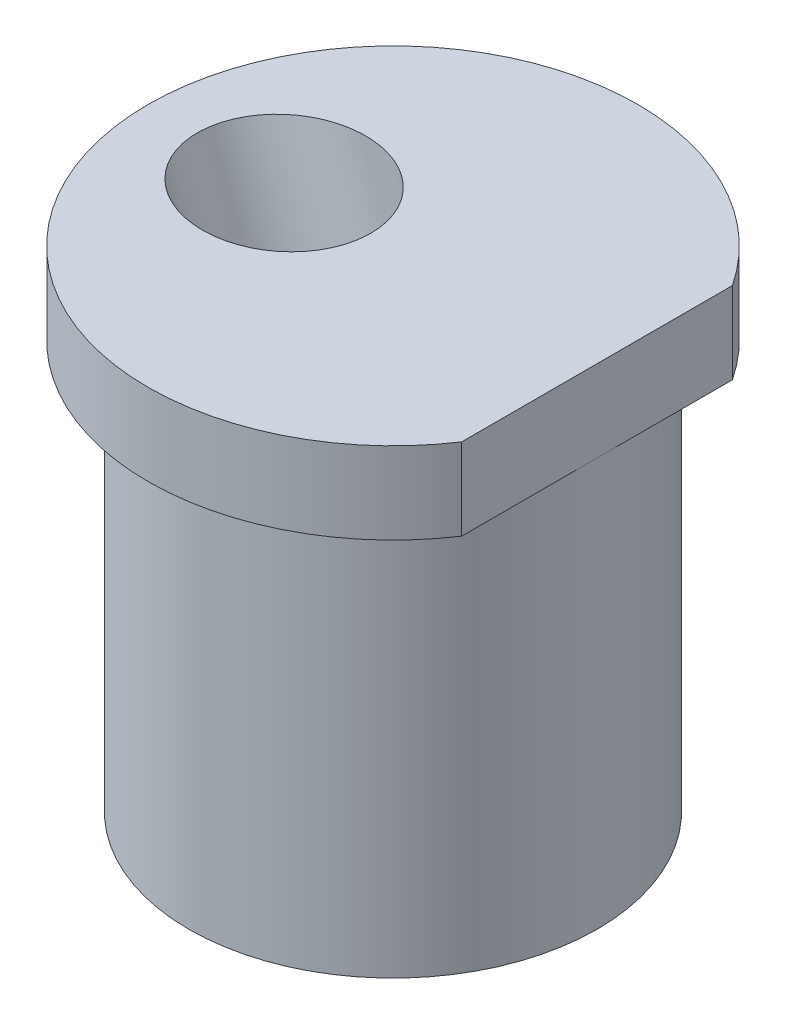
from build123d import *

# Parameters (mm, degrees)
SKETCH4_W          = 19.505959246
SKETCH4_H          = 52.283096245
CUT_EXTRUDE1_DEPTH = 18


with BuildPart() as part:
    # Sketch1 → Revolve1 (revolve)
    with BuildSketch(Plane.XY, mode=Mode.PRIVATE) as revolve1_sk:
        Polygon((0, 0), (0, 60), (30, 60), (30, 50), (25, 50), (25, 0), align=None)
    revolve(revolve1_sk.sketch.rotate(Axis((0, 0, 0), (0, 1, 0)), 90), axis=Axis((0, 0, 0), (0, 1, 0)))

    # Sketch4 → Cut-Extrude1 (cut)
    with BuildSketch(Plane(origin=(0, 60, 0), x_dir=(1, 0, 0), z_dir=(0, 1, 0))):
        with Locations((34.752979623, -0.356273229)):
            Rectangle(SKETCH4_W, SKETCH4_H)
    extrude(amount=-CUT_EXTRUDE1_DEPTH, mode=Mode.SUBTRACT)

    # Sketch5 → Cut-Revolve1 (revolve, cut)
    with BuildSketch(Plane.XY, mode=Mode.PRIVATE) as cut_revolve1_sk:
        Polygon((-23.756678995, 88.624497165), (16.900700587, -23.08073517), (24.418241553, -20.344574023), (-16.239138029, 91.360658312), align=None)
    revolve(cut_revolve1_sk.sketch.rotate(Axis((-23.756678995, 88.624497165, 0), (0.34202014332567277, -0.939692620785907, 0)), 180), axis=Axis((-23.756678995, 88.624497165, 0), (0.34202014332567277, -0.939692620785907, 0)), mode=Mode.SUBTRACT)

    # Sketch6 → Cut-Revolve2 (revolve, cut)
    with BuildSketch(Plane.XY):
        Polygon((-9.693720942, 50), (-17.792178214, 72.250328486), (-8.395252006, 75.670529919), (-0.296794735, 53.420201433), (0.387245552, 51.540816192), (-9.009680656, 48.120614758), align=None)
    revolve(axis=Axis((-9.693720942, 50, 0), (-0.3420201433256727, 0.939692620785907, 0)), mode=Mode.SUBTRACT)


solid = part.part
